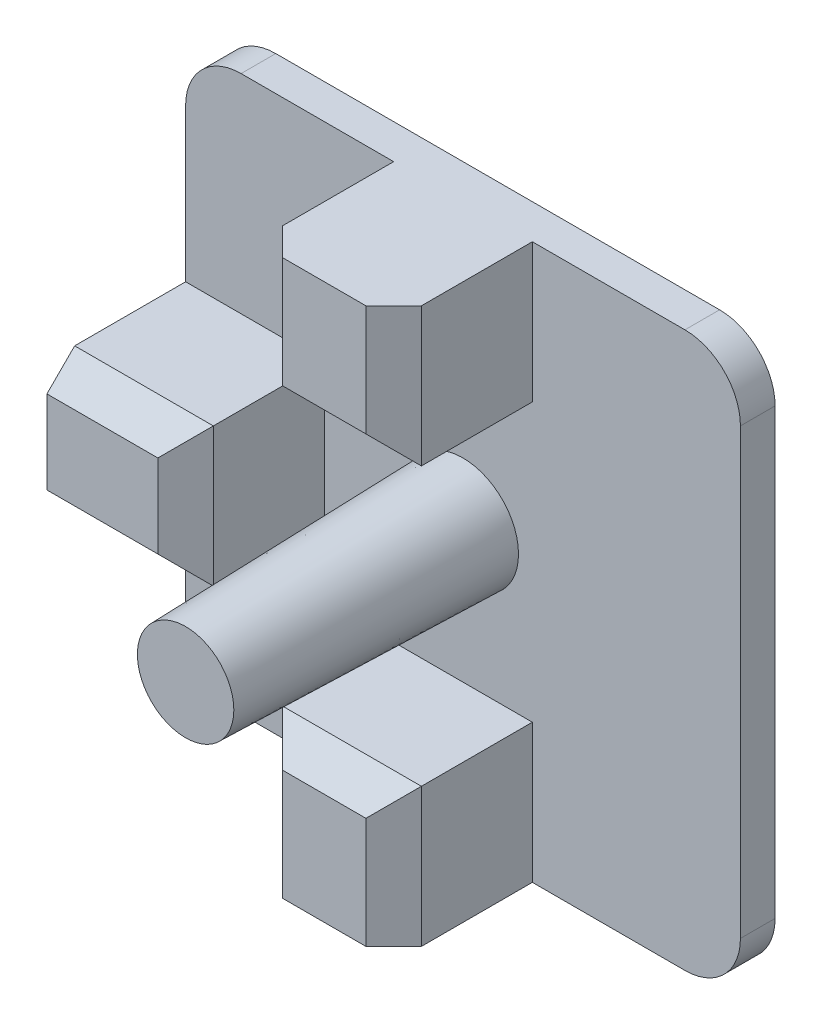
from build123d import *

# Parameters (mm, degrees)
BOSS_EXTRUDE1_DEPTH = 1.5875
SKETCH2_W           = 6.35
SKETCH2_H           = 6.35
BOSS_EXTRUDE3_DEPTH = 6.35
SKETCH2_4_R         = 2.54
BOSS_EXTRUDE4_DEPTH = 12.7
BOSS_EXTRUDE4_TAPER = 1.5
CHAMFER1_SIZE       = 1.27


with BuildPart() as part:
    # Sketch1 → Boss-Extrude1 (new body)
    with BuildSketch(Plane.XY):
        with BuildLine():
            Line((-10.16, 12.7), (10.16, 12.7))
            ThreePointArc((10.16, 12.7), (11.956051224, 11.956051224), (12.7, 10.16))
            Line((12.7, 10.16), (12.7, -10.16))
            ThreePointArc((12.7, -10.16), (11.956051224, -11.956051224), (10.16, -12.7))
            Line((10.16, -12.7), (-10.16, -12.7))
            ThreePointArc((-10.16, -12.7), (-11.956051224, -11.956051224), (-12.7, -10.16))
            Line((-12.7, -10.16), (-12.7, 10.16))
            ThreePointArc((-12.7, 10.16), (-11.956051224, 11.956051224), (-10.16, 12.7))
        make_face()
    extrude(amount=BOSS_EXTRUDE1_DEPTH)

    # Sketch2 → Boss-Extrude3 (add)
    with BuildSketch(Plane.XY.offset(1.5875)):
        with Locations((-9.525, 0)):
            Rectangle(SKETCH2_W, SKETCH2_H)
        with Locations((0, 9.525)):
            Rectangle(SKETCH2_W, SKETCH2_H)
        with Locations((0, -9.525)):
            Rectangle(SKETCH2_W, SKETCH2_H)
    extrude(amount=BOSS_EXTRUDE3_DEPTH)

    # Sketch2<4> → Boss-Extrude4 (add)
    with BuildSketch(Plane.XY.offset(1.5875)):
        Circle(SKETCH2_4_R)
    extrude(amount=BOSS_EXTRUDE4_DEPTH, taper=BOSS_EXTRUDE4_TAPER)

    # Chamfer1
    chamfer1_edges = [part.edges().sort_by_distance(p)[0] for p in [
        (3.175, 9.525, 7.9375),
        (-3.175, 9.525, 7.9375),
        (0, 6.35, 7.9375),
        (-9.525, -3.175, 7.9375),
        (-9.525, 3.175, 7.9375),
        (-6.35, 0, 7.9375),
        (-3.175, -9.525, 7.9375),
        (3.175, -9.525, 7.9375),
        (0, -6.35, 7.9375),
    ]]
    chamfer(chamfer1_edges, length=CHAMFER1_SIZE)


solid = part.part
